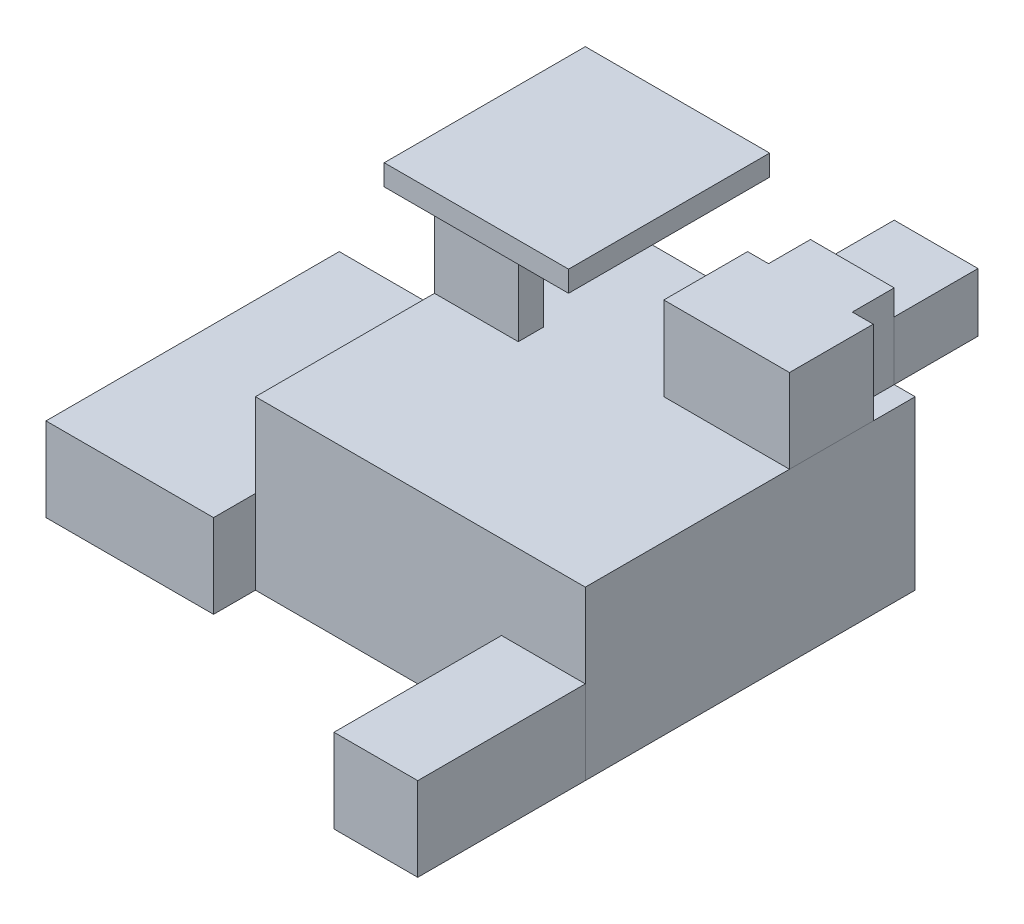
from build123d import *

# Parameters (mm, degrees)
SKETCH1_W          = 50
SKETCH1_H          = 50
MAIN_BOARDS_DEPTH  = 25.4
SKETCH2_W          = 12.7
SKETCH2_H          = 12.7
USB_DEPTH          = 25.4
SKETCH3_W          = 44.45
SKETCH3_H          = 12.7
PICKIT_DEPTH       = 25.4
HBRIDGE_DEPTH      = 12.7
SKETCH5_W          = 12.7
SKETCH5_H          = 12.7
MOTOR_WIRING_DEPTH = 8.89
SKETCH6_W          = 12.7
SKETCH6_H          = 3.81
HEADER_DEPTH       = 11.43
SKETCH7_W          = 27.94
SKETCH7_H          = 30.48
OLED_DEPTH         = 3.175


with BuildPart() as part:
    # Sketch1 → main boards (new body)
    with BuildSketch(Plane(origin=(0, 0, 0), x_dir=(1, 0, 0), z_dir=(0, 1, 0))):
        with Locations((25, 25)):
            Rectangle(SKETCH1_W, SKETCH1_H)
    extrude(amount=MAIN_BOARDS_DEPTH)


with BuildPart() as body_2:
    # Sketch2 → USB (new body)
    with BuildSketch(Plane.XY):
        with Locations((43.65, 6.35)):
            Rectangle(SKETCH2_W, SKETCH2_H)
    extrude(amount=USB_DEPTH)


with BuildPart() as body_3:
    # Sketch3 → PICKIT (new body)
    with BuildSketch(Plane.ZY):
        with Locations((-15.875, 6.35)):
            Rectangle(SKETCH3_W, SKETCH3_H)
    extrude(amount=PICKIT_DEPTH)


with BuildPart() as body_4:
    # Sketch4 → hbridge (new body)
    with BuildSketch(Plane(origin=(0, 25.4, 0), x_dir=(1, 0, 0), z_dir=(0, 1, 0))):
        Polygon((50, 43.65), (46.825, 43.65), (46.825, 50), (34.125, 50), (34.125, 43.65), (30.95, 43.65), (30.95, 30.95), (50, 30.95), align=None)
    extrude(amount=HBRIDGE_DEPTH)


with BuildPart() as body_5:
    # Sketch5 → motor wiring (new body)
    with BuildSketch(Plane(origin=(0, 25.4, 0), x_dir=(1, 0, 0), z_dir=(0, 1, 0))):
        with Locations((40.475, 56.35)):
            Rectangle(SKETCH5_W, SKETCH5_H)
    extrude(amount=MOTOR_WIRING_DEPTH)


with BuildPart() as body_6:
    # Sketch6 → header (new body)
    with BuildSketch(Plane(origin=(0, 25.4, 0), x_dir=(1, 0, 0), z_dir=(0, 1, 0))):
        with Locations((6.35, 29.045)):
            Rectangle(SKETCH6_W, SKETCH6_H)
    extrude(amount=HEADER_DEPTH)


with BuildPart() as body_7:
    # Sketch7 → OLED (new body)
    with BuildSketch(Plane(origin=(0, 36.83, 0), x_dir=(1, 0, 0), z_dir=(0, 1, 0))):
        with Locations((7.62, 41.11)):
            Rectangle(SKETCH7_W, SKETCH7_H)
    extrude(amount=OLED_DEPTH)


solid = Compound([part.part, body_2.part, body_3.part, body_4.part, body_5.part, body_6.part, body_7.part])
